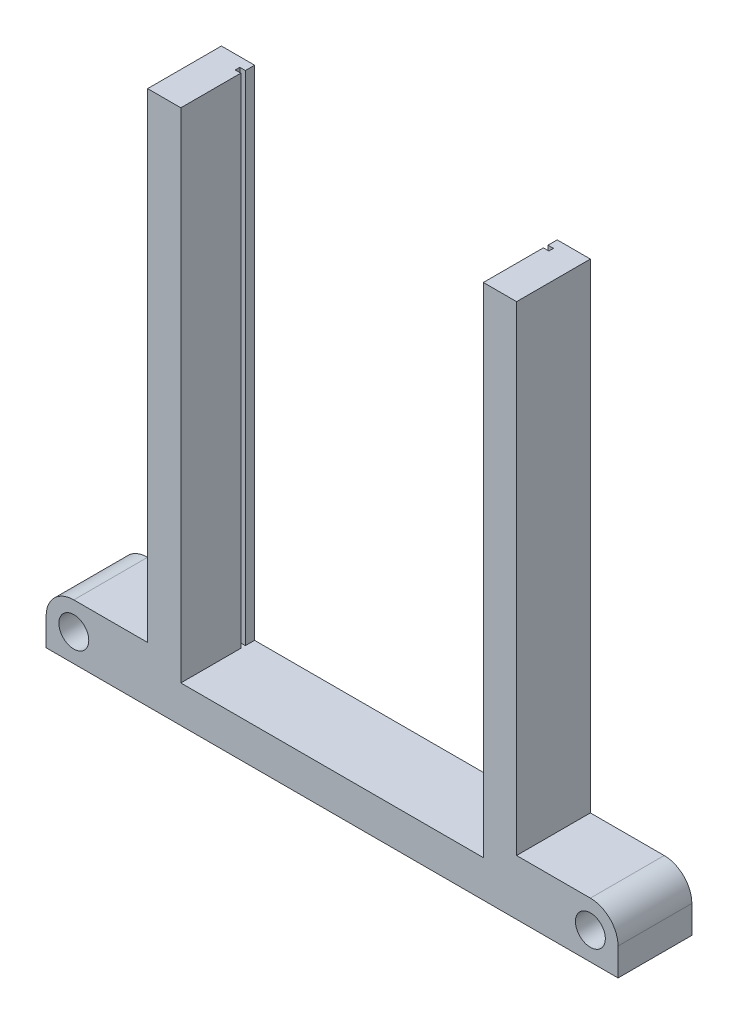
from build123d import *

# Parameters (mm, degrees)
SKETCH1_R           = 4.05
BOSS_EXTRUDE1_DEPTH = 10
CUT_EXTRUDE1_DEPTH  = 135


with BuildPart() as part:
    # Sketch1 → Boss-Extrude1 (new, symmetric)
    with BuildSketch(Plane.XY):
        with BuildLine():
            Line((-77.5, 0), (77.5, 0))
            Line((77.5, 0), (77.5, 7.5))
            ThreePointArc((77.5, 7.5), (75.303300859, 12.803300859), (70, 15))
            Line((70, 15), (50, 15))
            Line((50, 15), (50, 145))
            Line((50, 145), (-50, 145))
            Line((-50, 145), (-50, 15))
            Line((-50, 15), (-70, 15))
            ThreePointArc((-70, 15), (-75.303300859, 12.803300859), (-77.5, 7.5))
            Line((-77.5, 7.5), (-77.5, 0))
        make_face()
        with Locations((-70, 7.5)):
            Circle(SKETCH1_R, mode=Mode.SUBTRACT)
        with Locations((70, 7.5)):
            Circle(SKETCH1_R, mode=Mode.SUBTRACT)
    extrude(amount=BOSS_EXTRUDE1_DEPTH, both=True)

    # Sketch2 → Cut-Extrude1 (cut)
    with BuildSketch(Plane(origin=(0, 145, 0), x_dir=(1, 0, 0), z_dir=(0, 1, 0))):
        Polygon((-41, -10), (-41, 6.25), (-42.5, 6.25), (-42.5, 7.5), (-41, 7.5), (-41, 10), (41, 10), (41, 7.5), (42.5, 7.5), (42.5, 6.25), (41, 6.25), (41, -10), align=None)
    extrude(amount=-CUT_EXTRUDE1_DEPTH, mode=Mode.SUBTRACT)


solid = part.part
